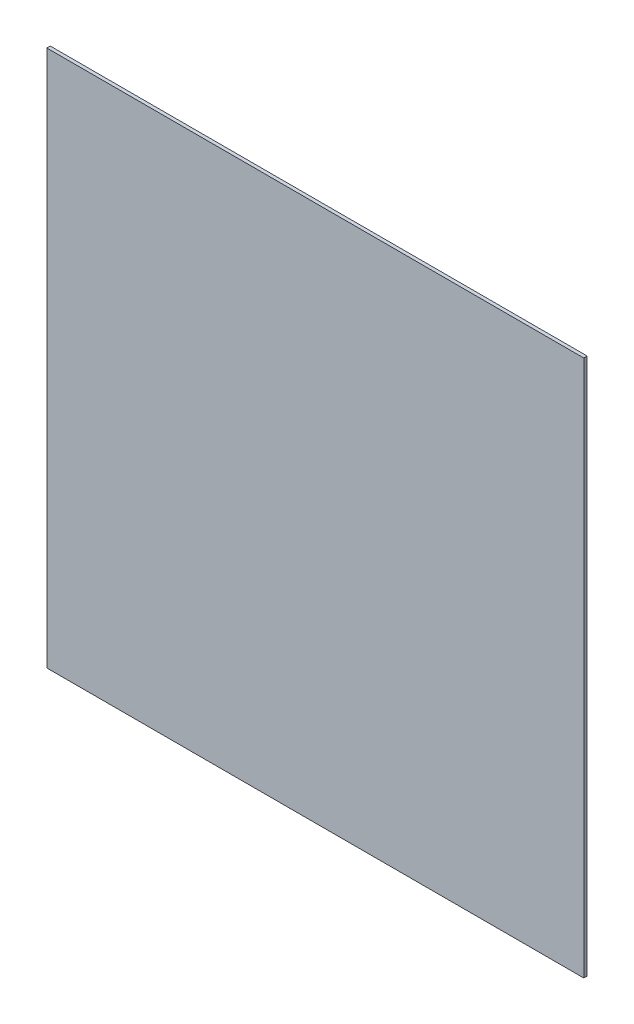
from build123d import *

# Parameters (mm, degrees)
SKETCH1_W           = 469.9
SKETCH1_H           = 469.9
BOSS_EXTRUDE1_DEPTH = 3


with BuildPart() as part:
    # Sketch1 → Boss-Extrude1 (new body)
    with BuildSketch(Plane.XY):
        with Locations((1362.254893919, -319.193351591)):
            Rectangle(SKETCH1_W, SKETCH1_H)
    extrude(amount=BOSS_EXTRUDE1_DEPTH)


solid = part.part
